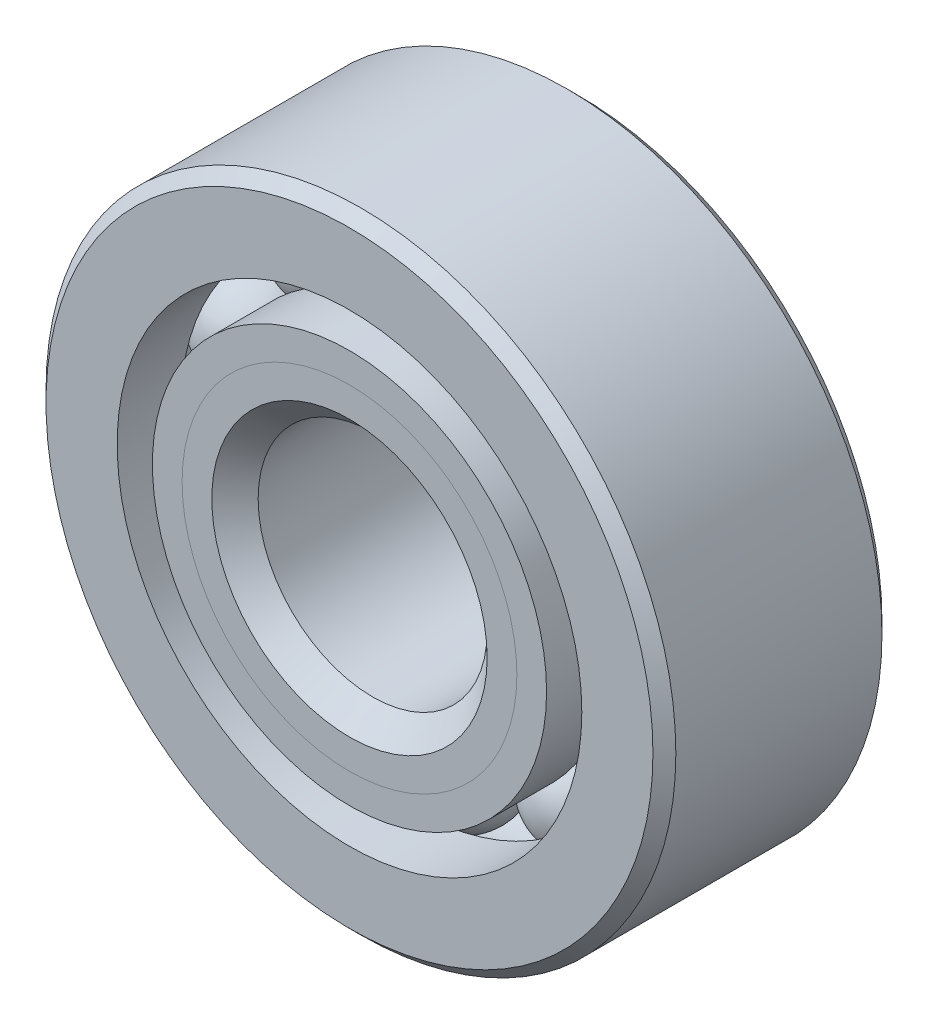
from build123d import *

# Parameters (mm, degrees)
CIRPATTERN1_COUNT = 10


with BuildPart() as part:
    # Sketch1 → Revolve1 (revolve)
    with BuildSketch(Plane(origin=(0, 0, 0), x_dir=(0, 0, -1), z_dir=(1, 0, 0)), mode=Mode.PRIVATE) as revolve1_sk:
        with BuildLine():
            Line((2.8575, 8.73125), (-2.8575, 8.73125))
            Line((-2.8575, 8.73125), (-3.175, 8.41375))
            Line((-3.175, 8.41375), (-3.175, 6.441586538))
            Line((-3.175, 6.441586538), (-1.411111111, 6.441586538))
            ThreePointArc((-1.411111111, 6.441586538), (0, 7.446386277), (1.411111111, 6.441586538))
            Line((1.411111111, 6.441586538), (3.175, 6.441586538))
            Line((3.175, 6.441586538), (3.175, 8.41375))
            Line((3.175, 8.41375), (2.8575, 8.73125))
        make_face()
    revolve(revolve1_sk.sketch.rotate(Axis((0, 0, 3.175), (0, 0, -1)), 90), axis=Axis((0, 0, 3.175), (0, 0, -1)))


with BuildPart() as body_2:
    # Sketch2 → Revolve2 (revolve)
    with BuildSketch(Plane(origin=(0, 0, 0), x_dir=(0, 0, -1), z_dir=(1, 0, 0)), mode=Mode.PRIVATE) as revolve2_sk:
        with BuildLine():
            Line((-3.175, 5.464663462), (-1.411111111, 5.464663462))
            ThreePointArc((-1.411111111, 5.464663462), (-0.866149104, 4.73673075), (0, 4.459863723))
            Line((0, 4.459863723), (0, 3.817431861))
            Line((0, 3.817431861), (-2.3513842, 3.817431861))
            Line((-2.3513842, 3.817431861), (-3.175, 4.641047661))
            Line((-3.175, 4.641047661), (-3.175, 5.464663462))
        make_face()
    revolve(revolve2_sk.sketch.rotate(Axis((0, 0, 3.175), (0, 0, -1)), 90), axis=Axis((0, 0, 3.175), (0, 0, -1)))


with BuildPart() as body_3:
    # Sketch3 → Revolve3 (revolve)
    with BuildSketch(Plane(origin=(0, 0, 0), x_dir=(0, 0, -1), z_dir=(1, 0, 0)), mode=Mode.PRIVATE) as revolve3_sk:
        with BuildLine():
            Line((-3.175, 4.641047661), (-2.3513842, 3.817431861))
            Line((-2.3513842, 3.817431861), (0, 3.817431861))
            Line((0, 3.817431861), (0, 4.459863723))
            ThreePointArc((0, 4.459863723), (0.866149104, 4.73673075), (1.411111111, 5.464663462))
            Line((1.411111111, 5.464663462), (3.175, 5.464663462))
            Line((3.175, 5.464663462), (3.175, 3.4925))
            Line((3.175, 3.4925), (2.8575, 3.175))
            Line((2.8575, 3.175), (-2.532568139, 3.175))
            Line((-2.532568139, 3.175), (-3.175, 3.817431861))
            Line((-3.175, 3.817431861), (-3.175, 4.641047661))
        make_face()
    revolve(revolve3_sk.sketch.rotate(Axis((0, 0, 3.175), (0, 0, -1)), 90), axis=Axis((0, 0, 3.175), (0, 0, -1)))


with BuildPart() as body_4:
    # Sketch4 → Revolve4 (revolve)
    with BuildSketch(Plane(origin=(0, 0, 0), x_dir=(0, 0, -1), z_dir=(1, 0, 0))):
        with BuildLine():
            Line((-1.493261277, 5.953125), (1.493261277, 5.953125))
            ThreePointArc((1.493261277, 5.953125), (0, 7.446386277), (-1.493261277, 5.953125))
        make_face()
    revolve(axis=Axis((0, 5.953125, 1.493261277), (0, 0, -1)))


with BuildPart() as cirpattern1_1:
    # CirPattern1: pattern copy
    add(body_4.part.rotate(Axis((0, 0, 0), (0, 0, 1)), 1 * 360 / CIRPATTERN1_COUNT))


with BuildPart() as cirpattern1_2:
    # CirPattern1: pattern copy
    add(body_4.part.rotate(Axis((0, 0, 0), (0, 0, 1)), 2 * 360 / CIRPATTERN1_COUNT))


with BuildPart() as cirpattern1_3:
    # CirPattern1: pattern copy
    add(body_4.part.rotate(Axis((0, 0, 0), (0, 0, 1)), 3 * 360 / CIRPATTERN1_COUNT))


with BuildPart() as cirpattern1_4:
    # CirPattern1: pattern copy
    add(body_4.part.rotate(Axis((0, 0, 0), (0, 0, 1)), 4 * 360 / CIRPATTERN1_COUNT))


with BuildPart() as cirpattern1_5:
    # CirPattern1: pattern copy
    add(body_4.part.rotate(Axis((0, 0, 0), (0, 0, 1)), 5 * 360 / CIRPATTERN1_COUNT))


with BuildPart() as cirpattern1_6:
    # CirPattern1: pattern copy
    add(body_4.part.rotate(Axis((0, 0, 0), (0, 0, 1)), 6 * 360 / CIRPATTERN1_COUNT))


with BuildPart() as cirpattern1_7:
    # CirPattern1: pattern copy
    add(body_4.part.rotate(Axis((0, 0, 0), (0, 0, 1)), 7 * 360 / CIRPATTERN1_COUNT))


with BuildPart() as cirpattern1_8:
    # CirPattern1: pattern copy
    add(body_4.part.rotate(Axis((0, 0, 0), (0, 0, 1)), 8 * 360 / CIRPATTERN1_COUNT))


with BuildPart() as cirpattern1_9:
    # CirPattern1: pattern copy
    add(body_4.part.rotate(Axis((0, 0, 0), (0, 0, 1)), 9 * 360 / CIRPATTERN1_COUNT))


solid = Compound([part.part, body_2.part, body_3.part, body_4.part, cirpattern1_1.part, cirpattern1_2.part, cirpattern1_3.part, cirpattern1_4.part, cirpattern1_5.part, cirpattern1_6.part, cirpattern1_7.part, cirpattern1_8.part, cirpattern1_9.part])
